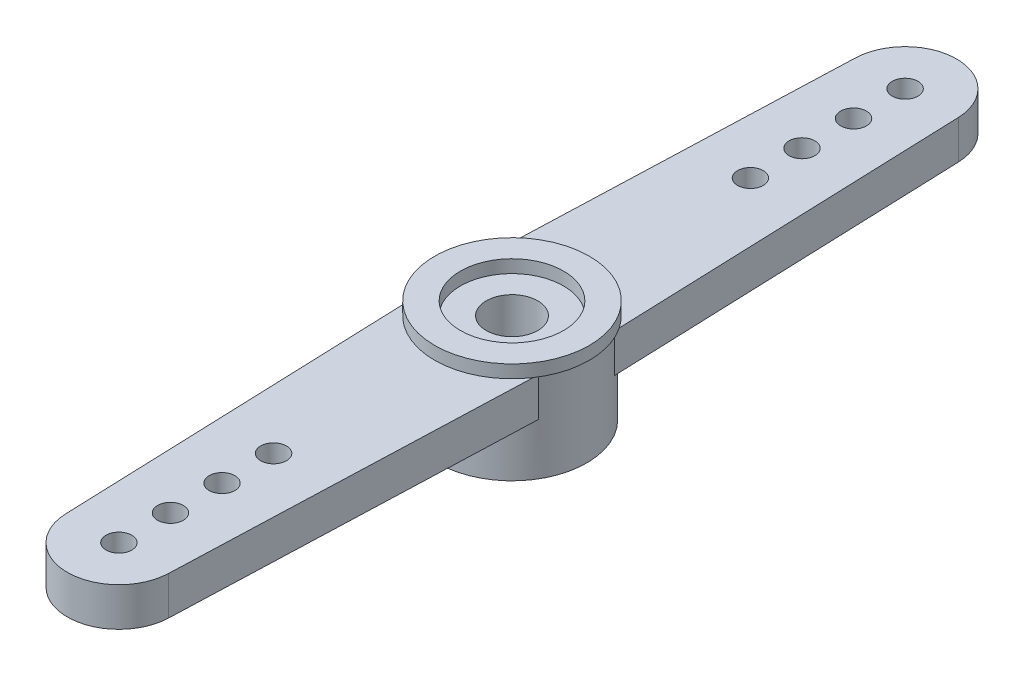
from build123d import *

# Parameters (mm, degrees)
ESQUISSE1_R                            = 2.9
ESQUISSE1_R_2                          = 2
BOSS_EXTRU_1_DEPTH                     = 2
BOSS_EXTRU_2_START                     = 1.5
ESQUISSE2_R                            = 1
BOSS_EXTRU_2_DEPTH                     = 1.5
ESQUISSE4_R                            = 0.5
ENL_V_MAT_EXTRU_1_DEPTH                = 18.838791999
R_P_TITION_LIN_AIRE1_COUNT             = 4
R_P_TITION_LIN_AIRE1_PITCH             = 2
R_P_TITION_CIRCULAIRE1_COUNT           = 2
R_P_TITION_CIRCULAIRE1_COPY_1_SKETCH_R = 0.5
R_P_TITION_CIRCULAIRE1_COPY_1_DEPTH    = 18.838791999
R_P_TITION_CIRCULAIRE1_COPY_2_SKETCH_R = 0.5
R_P_TITION_CIRCULAIRE1_COPY_2_DEPTH    = 18.838791999
R_P_TITION_CIRCULAIRE1_COPY_3_SKETCH_R = 0.5
R_P_TITION_CIRCULAIRE1_COPY_3_DEPTH    = 18.838791999
BOSS_EXTRU_3_START                     = 0.5
ESQUISSE3_R                            = 3
ESQUISSE3_R_2                          = 2
BOSS_EXTRU_3_DEPTH                     = 0.5


with BuildPart() as part:
    # Esquisse1 → Boss.-Extru.1 (new body)
    with BuildSketch(Plane(origin=(0, 0, 0), x_dir=(1, 0, 0), z_dir=(0, 1, 0))):
        with Locations(Location((0, 0, 0), (0, 0, 270))):
            Circle(ESQUISSE1_R)
        with Locations(Location((0, 0, 0), (0, 0, 270))):
            Circle(ESQUISSE1_R_2, mode=Mode.SUBTRACT)
    extrude(amount=-BOSS_EXTRU_1_DEPTH)

    # Esquisse2 → Boss.-Extru.2 (add)
    with BuildSketch(Plane(origin=(0, 0, 0), x_dir=(1, 0, 0), z_dir=(0, 1, 0)).offset(BOSS_EXTRU_2_START)):
        with BuildLine():
            Line((-1.998691666, 15.322329972), (-2.5, 1.469693846))
            ThreePointArc((-2.5, 1.469693846), (0, -2.9), (2.5, 1.469693846))
            Line((2.5, 1.469693846), (1.998691666, 15.322329972))
            ThreePointArc((1.998691666, 15.322329972), (0, 17.25), (-1.998691666, 15.322329972))
        make_face()
        with Locations(Location((0, 0, 0), (0, 0, 270))):
            Circle(ESQUISSE2_R, mode=Mode.SUBTRACT)
    boss_extru_2 = extrude(amount=-BOSS_EXTRU_2_DEPTH)

    # Esquisse4 → Enlèv. mat.-Extru.1 (cut, through all)
    with BuildSketch(Plane(origin=(0, 1.5, 0), x_dir=(1, 0, 0), z_dir=(0, 1, 0))):
        with Locations(Location((0, 15.25, 0), (0, 0, 270))):
            Circle(ESQUISSE4_R)
    enl_v_mat_extru_1 = extrude(amount=-ENL_V_MAT_EXTRU_1_DEPTH, mode=Mode.SUBTRACT)

    # Répétition linéaire1: Enlèv. mat.-Extru.1 ×4
    with Locations(*[(0, 0, i * R_P_TITION_LIN_AIRE1_PITCH) for i in range(1, R_P_TITION_LIN_AIRE1_COUNT)]):
        add(enl_v_mat_extru_1, mode=Mode.SUBTRACT)

    # Répétition circulaire1: Boss.-Extru.2, Enlèv. mat.-Extru.1 ×2 about axis
    r_p_tition_circulaire1_axis = Axis((0, 0, 0), (0, 1, 0))
    add([boss_extru_2.rotate(r_p_tition_circulaire1_axis, i * 360 / R_P_TITION_CIRCULAIRE1_COUNT) for i in range(1, R_P_TITION_CIRCULAIRE1_COUNT)])
    add([enl_v_mat_extru_1.rotate(r_p_tition_circulaire1_axis, i * 360 / R_P_TITION_CIRCULAIRE1_COUNT) for i in range(1, R_P_TITION_CIRCULAIRE1_COUNT)], mode=Mode.SUBTRACT)

    # Répétition circulaire1 copy 1 sketch → Répétition circulaire1 copy 1 (cut, through all)
    with BuildSketch(Plane(origin=(0, 1.5, -2), x_dir=(-1, 0, 0), z_dir=(0, 1, 0))):
        with Locations(Location((0, 15.25, 0), (0, 0, 270))):
            Circle(R_P_TITION_CIRCULAIRE1_COPY_1_SKETCH_R)
    extrude(amount=-R_P_TITION_CIRCULAIRE1_COPY_1_DEPTH, mode=Mode.SUBTRACT)

    # Répétition circulaire1 copy 2 sketch → Répétition circulaire1 copy 2 (cut, through all)
    with BuildSketch(Plane(origin=(0, 1.5, -4), x_dir=(-1, 0, 0), z_dir=(0, 1, 0))):
        with Locations(Location((0, 15.25, 0), (0, 0, 270))):
            Circle(R_P_TITION_CIRCULAIRE1_COPY_2_SKETCH_R)
    extrude(amount=-R_P_TITION_CIRCULAIRE1_COPY_2_DEPTH, mode=Mode.SUBTRACT)

    # Répétition circulaire1 copy 3 sketch → Répétition circulaire1 copy 3 (cut, through all)
    with BuildSketch(Plane(origin=(0, 1.5, -6), x_dir=(-1, 0, 0), z_dir=(0, 1, 0))):
        with Locations(Location((0, 15.25, 0), (0, 0, 270))):
            Circle(R_P_TITION_CIRCULAIRE1_COPY_3_SKETCH_R)
    extrude(amount=-R_P_TITION_CIRCULAIRE1_COPY_3_DEPTH, mode=Mode.SUBTRACT)

    # Esquisse3 → Boss.-Extru.3 (add)
    with BuildSketch(Plane(origin=(0, 1.5, 0), x_dir=(1, 0, 0), z_dir=(0, 1, 0)).offset(BOSS_EXTRU_3_START)):
        with Locations(Location((0, 0, 0), (0, 0, 33.805876752))):
            Circle(ESQUISSE3_R)
        with Locations(Location((0, 0, 0), (0, 0, 270))):
            Circle(ESQUISSE3_R_2, mode=Mode.SUBTRACT)
    extrude(amount=-BOSS_EXTRU_3_DEPTH)


solid = part.part
